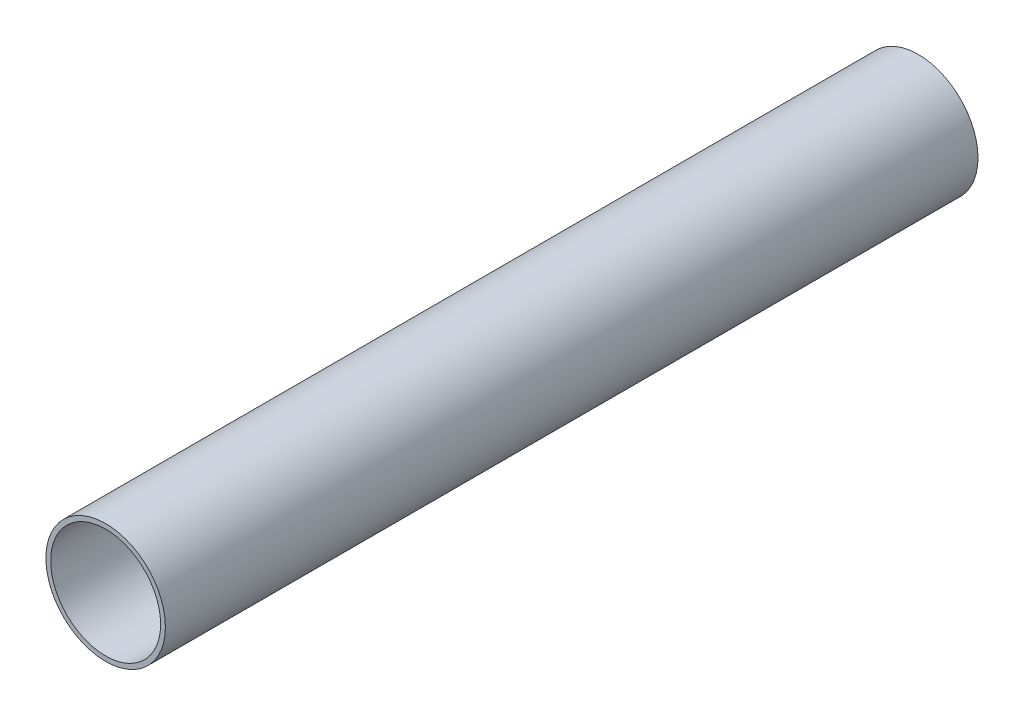
from build123d import *

# Parameters (mm, degrees)
SKETCH1_R           = 12.5
SKETCH1_R_2         = 11.5
BOSS_EXTRUDE1_DEPTH = 170


with BuildPart() as part:
    # Sketch1 → Boss-Extrude1 (new body)
    with BuildSketch(Plane.XY):
        Circle(SKETCH1_R)
        Circle(SKETCH1_R_2, mode=Mode.SUBTRACT)
    extrude(amount=BOSS_EXTRUDE1_DEPTH)


solid = part.part
